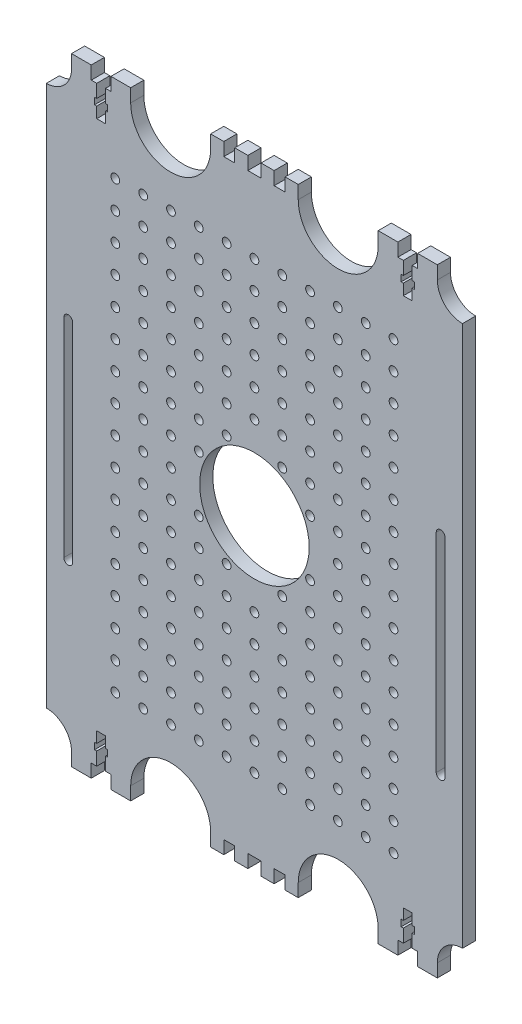
from build123d import *

# Parameters (mm, degrees)
ESQUISSE1_W               = 190
ESQUISSE1_H               = 270
BOSS_EXTRU_1_DEPTH        = 6
ESQUISSE2_W               = 9
ESQUISSE2_H               = 6
BOSS_EXTRU_2_DEPTH        = 6
ENL_V_MAT_EXTRU_1_DEPTH   = 6
SYM_TRIE2_COPY_1_SKETCH_W = 9
SYM_TRIE2_COPY_1_SKETCH_H = 6
SYM_TRIE2_COPY_1_DEPTH    = 6
SYM_TRIE2_COPY_2_DEPTH    = 6
ESQUISSE4_W               = 6
ESQUISSE4_H               = 6
BOSS_EXTRU_3_DEPTH        = 6
ESQUISSE6_R               = 18.25
ESQUISSE6_R_2             = 11.5
ESQUISSE6_R_3             = 25
ENL_V_MAT_EXTRU_2_DEPTH   = 6
ENL_V_MAT_EXTRU_3_DEPTH   = 6
ESQUISSE8_R               = 2
ENL_V_MAT_EXTRU_4_DEPTH   = 6


with BuildPart() as part:
    # Esquisse1 → Boss.-Extru.1 (new body)
    with BuildSketch(Plane.XY):
        Rectangle(ESQUISSE1_W, ESQUISSE1_H)
    extrude(amount=BOSS_EXTRU_1_DEPTH)

    # Esquisse2 → Boss.-Extru.2 (add)
    with BuildSketch(Plane.XZ.offset(135)):
        with Locations((-79, 3)):
            Rectangle(ESQUISSE2_W, ESQUISSE2_H)
        with Locations((-61, 3)):
            Rectangle(ESQUISSE2_W, ESQUISSE2_H)
    boss_extru_2 = extrude(amount=BOSS_EXTRU_2_DEPTH)

    # Esquisse3 → Enlèv. mat.-Extru.1 (cut)
    with BuildSketch(Plane(origin=(0, 0, 0), x_dir=(-1, 0, 0), z_dir=(0, 0, -1))):
        Polygon((68, -135), (72, -135), (72, -129), (73, -129), (73, -126), (72, -126), (72, -121), (68, -121), (68, -126), (67, -126), (67, -129), (68, -129), align=None)
    enl_v_mat_extru_1 = extrude(amount=-ENL_V_MAT_EXTRU_1_DEPTH, mode=Mode.SUBTRACT)

    # Symétrie1: Boss.-Extru.2, Enlèv. mat.-Extru.1 across plane
    add(boss_extru_2.mirror(Plane.ZX))
    add(enl_v_mat_extru_1.mirror(Plane.ZX), mode=Mode.SUBTRACT)

    # Symétrie2: Boss.-Extru.2, Enlèv. mat.-Extru.1 across plane
    add(boss_extru_2.mirror(Plane.ZY))
    add(enl_v_mat_extru_1.mirror(Plane.ZY), mode=Mode.SUBTRACT)

    # Symétrie2 copy 1 sketch → Symétrie2 copy 1 (add)
    with BuildSketch(Plane(origin=(0, 135, 0), x_dir=(-1, 0, 0), z_dir=(0, 1, 0))):
        with Locations((-79, 3)):
            Rectangle(SYM_TRIE2_COPY_1_SKETCH_W, SYM_TRIE2_COPY_1_SKETCH_H)
        with Locations((-61, 3)):
            Rectangle(SYM_TRIE2_COPY_1_SKETCH_W, SYM_TRIE2_COPY_1_SKETCH_H)
    extrude(amount=SYM_TRIE2_COPY_1_DEPTH)

    # Symétrie2 copy 2 sketch → Symétrie2 copy 2 (cut)
    with BuildSketch(Plane(origin=(0, 0, 0), x_dir=(1, 0, 0), z_dir=(0, 0, -1))):
        Polygon((68, -135), (72, -135), (72, -129), (73, -129), (73, -126), (72, -126), (72, -121), (68, -121), (68, -126), (67, -126), (67, -129), (68, -129), align=None)
    extrude(amount=-SYM_TRIE2_COPY_2_DEPTH, mode=Mode.SUBTRACT)

    # Esquisse4 → Boss.-Extru.3 (add)
    with BuildSketch(Plane.XZ.offset(135)):
        with Locations((17, 3)):
            Rectangle(ESQUISSE4_W, ESQUISSE4_H)
        with Locations((6, 3)):
            Rectangle(ESQUISSE4_W, ESQUISSE4_H)
        with Locations((-17, 3)):
            Rectangle(ESQUISSE4_W, ESQUISSE4_H)
        with Locations((-6, 3)):
            Rectangle(ESQUISSE4_W, ESQUISSE4_H)
    boss_extru_3 = extrude(amount=BOSS_EXTRU_3_DEPTH)

    # Symétrie3: Boss.-Extru.3 across plane
    add(boss_extru_3.mirror(Plane.ZX))

    # Esquisse6 → Enlèv. mat.-Extru.2 (cut)
    with BuildSketch(Plane.XY.offset(6)):
        with Locations((-38.25, 135)):
            Circle(ESQUISSE6_R)
        with Locations((38.25, 135)):
            Circle(ESQUISSE6_R)
        with Locations((-38.25, -135)):
            Circle(ESQUISSE6_R)
        with Locations((38.25, -135)):
            Circle(ESQUISSE6_R)
        with Locations((-95, 135)):
            Circle(ESQUISSE6_R_2)
        with Locations((95, 135)):
            Circle(ESQUISSE6_R_2)
        with Locations((95, -135)):
            Circle(ESQUISSE6_R_2)
        with Locations((-95, -135)):
            Circle(ESQUISSE6_R_2)
        Circle(ESQUISSE6_R_3)
    extrude(amount=-ENL_V_MAT_EXTRU_2_DEPTH, mode=Mode.SUBTRACT)

    # Esquisse7 → Enlèv. mat.-Extru.3 (cut)
    with BuildSketch(Plane.XY.offset(6)):
        with BuildLine():
            Line((87, 35), (87, -60))
            ThreePointArc((87, -60), (85, -62), (83, -60))
            Line((83, -60), (83, 35))
            ThreePointArc((83, 35), (85, 37), (87, 35))
        make_face()
    enl_v_mat_extru_3 = extrude(amount=-ENL_V_MAT_EXTRU_3_DEPTH, mode=Mode.SUBTRACT)

    # Symétrie4: Enlèv. mat.-Extru.3 across plane
    add(enl_v_mat_extru_3.mirror(Plane(origin=(0, 0, 0), x_dir=(0, 0, 1), z_dir=(1, 0, 0))), mode=Mode.SUBTRACT)

    # Esquisse8 → Enlèv. mat.-Extru.4 (cut)
    with BuildSketch(Plane.XY.offset(6)):
        Circle(ESQUISSE8_R)
        with Locations((0, -12.7)):
            Circle(ESQUISSE8_R)
        with Locations((0, -38.1)):
            Circle(ESQUISSE8_R)
        with Locations((0, -50.8)):
            Circle(ESQUISSE8_R)
        with Locations((0, -63.5)):
            Circle(ESQUISSE8_R)
        with Locations((0, -76.2)):
            Circle(ESQUISSE8_R)
        with Locations((0, -88.9)):
            Circle(ESQUISSE8_R)
        with Locations((0, -101.6)):
            Circle(ESQUISSE8_R)
        with Locations((-12.7, -12.7)):
            Circle(ESQUISSE8_R)
        with Locations((-12.7, -25.4)):
            Circle(ESQUISSE8_R)
        with Locations((-12.7, -38.1)):
            Circle(ESQUISSE8_R)
        with Locations((-12.7, -50.8)):
            Circle(ESQUISSE8_R)
        with Locations((-12.7, -63.5)):
            Circle(ESQUISSE8_R)
        with Locations((-12.7, -76.2)):
            Circle(ESQUISSE8_R)
        with Locations((-12.7, -88.9)):
            Circle(ESQUISSE8_R)
        with Locations((-12.7, -101.6)):
            Circle(ESQUISSE8_R)
        with Locations((-25.4, -12.7)):
            Circle(ESQUISSE8_R)
        with Locations((-25.4, -25.4)):
            Circle(ESQUISSE8_R)
        with Locations((-25.4, -38.1)):
            Circle(ESQUISSE8_R)
        with Locations((-25.4, -50.8)):
            Circle(ESQUISSE8_R)
        with Locations((-25.4, -63.5)):
            Circle(ESQUISSE8_R)
        with Locations((-25.4, -76.2)):
            Circle(ESQUISSE8_R)
        with Locations((-25.4, -88.9)):
            Circle(ESQUISSE8_R)
        with Locations((-25.4, -101.6)):
            Circle(ESQUISSE8_R)
        with Locations((-38.1, -12.7)):
            Circle(ESQUISSE8_R)
        with Locations((-38.1, -25.4)):
            Circle(ESQUISSE8_R)
        with Locations((-38.1, -38.1)):
            Circle(ESQUISSE8_R)
        with Locations((-38.1, -50.8)):
            Circle(ESQUISSE8_R)
        with Locations((-38.1, -63.5)):
            Circle(ESQUISSE8_R)
        with Locations((-38.1, -76.2)):
            Circle(ESQUISSE8_R)
        with Locations((-38.1, -88.9)):
            Circle(ESQUISSE8_R)
        with Locations((-38.1, -101.6)):
            Circle(ESQUISSE8_R)
        with Locations((-50.8, -12.7)):
            Circle(ESQUISSE8_R)
        with Locations((-50.8, -25.4)):
            Circle(ESQUISSE8_R)
        with Locations((-50.8, -38.1)):
            Circle(ESQUISSE8_R)
        with Locations((-50.8, -50.8)):
            Circle(ESQUISSE8_R)
        with Locations((-50.8, -63.5)):
            Circle(ESQUISSE8_R)
        with Locations((-50.8, -76.2)):
            Circle(ESQUISSE8_R)
        with Locations((-50.8, -88.9)):
            Circle(ESQUISSE8_R)
        with Locations((-50.8, -101.6)):
            Circle(ESQUISSE8_R)
        with Locations((-63.5, -12.7)):
            Circle(ESQUISSE8_R)
        with Locations((-63.5, -25.4)):
            Circle(ESQUISSE8_R)
        with Locations((-63.5, -38.1)):
            Circle(ESQUISSE8_R)
        with Locations((-63.5, -50.8)):
            Circle(ESQUISSE8_R)
        with Locations((-63.5, -63.5)):
            Circle(ESQUISSE8_R)
        with Locations((-63.5, -76.2)):
            Circle(ESQUISSE8_R)
        with Locations((-63.5, -88.9)):
            Circle(ESQUISSE8_R)
        with Locations((-63.5, -101.6)):
            Circle(ESQUISSE8_R)
        with Locations((-12.7, 0)):
            Circle(ESQUISSE8_R)
        with Locations((-38.1, 0)):
            Circle(ESQUISSE8_R)
        with Locations((-50.8, 0)):
            Circle(ESQUISSE8_R)
        with Locations((-63.5, 0)):
            Circle(ESQUISSE8_R)
        with Locations((0, 12.7)):
            Circle(ESQUISSE8_R)
        with Locations((-12.7, 12.7)):
            Circle(ESQUISSE8_R)
        with Locations((-25.4, 12.7)):
            Circle(ESQUISSE8_R)
        with Locations((-38.1, 12.7)):
            Circle(ESQUISSE8_R)
        with Locations((-50.8, 12.7)):
            Circle(ESQUISSE8_R)
        with Locations((-63.5, 12.7)):
            Circle(ESQUISSE8_R)
        with Locations((-12.7, 25.4)):
            Circle(ESQUISSE8_R)
        with Locations((-25.4, 25.4)):
            Circle(ESQUISSE8_R)
        with Locations((-38.1, 25.4)):
            Circle(ESQUISSE8_R)
        with Locations((-50.8, 25.4)):
            Circle(ESQUISSE8_R)
        with Locations((-63.5, 25.4)):
            Circle(ESQUISSE8_R)
        with Locations((0, 38.1)):
            Circle(ESQUISSE8_R)
        with Locations((-12.7, 38.1)):
            Circle(ESQUISSE8_R)
        with Locations((-25.4, 38.1)):
            Circle(ESQUISSE8_R)
        with Locations((-38.1, 38.1)):
            Circle(ESQUISSE8_R)
        with Locations((-50.8, 38.1)):
            Circle(ESQUISSE8_R)
        with Locations((-63.5, 38.1)):
            Circle(ESQUISSE8_R)
        with Locations((0, 50.8)):
            Circle(ESQUISSE8_R)
        with Locations((-12.7, 50.8)):
            Circle(ESQUISSE8_R)
        with Locations((-25.4, 50.8)):
            Circle(ESQUISSE8_R)
        with Locations((-38.1, 50.8)):
            Circle(ESQUISSE8_R)
        with Locations((-50.8, 50.8)):
            Circle(ESQUISSE8_R)
        with Locations((-63.5, 50.8)):
            Circle(ESQUISSE8_R)
        with Locations((0, 63.5)):
            Circle(ESQUISSE8_R)
        with Locations((-12.7, 63.5)):
            Circle(ESQUISSE8_R)
        with Locations((-25.4, 63.5)):
            Circle(ESQUISSE8_R)
        with Locations((-38.1, 63.5)):
            Circle(ESQUISSE8_R)
        with Locations((-50.8, 63.5)):
            Circle(ESQUISSE8_R)
        with Locations((-63.5, 63.5)):
            Circle(ESQUISSE8_R)
        with Locations((0, 76.2)):
            Circle(ESQUISSE8_R)
        with Locations((-12.7, 76.2)):
            Circle(ESQUISSE8_R)
        with Locations((-25.4, 76.2)):
            Circle(ESQUISSE8_R)
        with Locations((-38.1, 76.2)):
            Circle(ESQUISSE8_R)
        with Locations((-50.8, 76.2)):
            Circle(ESQUISSE8_R)
        with Locations((-63.5, 76.2)):
            Circle(ESQUISSE8_R)
        with Locations((0, 88.9)):
            Circle(ESQUISSE8_R)
        with Locations((-12.7, 88.9)):
            Circle(ESQUISSE8_R)
        with Locations((-25.4, 88.9)):
            Circle(ESQUISSE8_R)
        with Locations((-38.1, 88.9)):
            Circle(ESQUISSE8_R)
        with Locations((-50.8, 88.9)):
            Circle(ESQUISSE8_R)
        with Locations((-63.5, 88.9)):
            Circle(ESQUISSE8_R)
        with Locations((0, 101.6)):
            Circle(ESQUISSE8_R)
        with Locations((-12.7, 101.6)):
            Circle(ESQUISSE8_R)
        with Locations((-25.4, 101.6)):
            Circle(ESQUISSE8_R)
        with Locations((-38.1, 101.6)):
            Circle(ESQUISSE8_R)
        with Locations((-50.8, 101.6)):
            Circle(ESQUISSE8_R)
        with Locations((-63.5, 101.6)):
            Circle(ESQUISSE8_R)
        with Locations((12.7, 101.6)):
            Circle(ESQUISSE8_R)
        with Locations((12.7, 88.9)):
            Circle(ESQUISSE8_R)
        with Locations((12.7, 76.2)):
            Circle(ESQUISSE8_R)
        with Locations((12.7, 63.5)):
            Circle(ESQUISSE8_R)
        with Locations((12.7, 50.8)):
            Circle(ESQUISSE8_R)
        with Locations((12.7, 38.1)):
            Circle(ESQUISSE8_R)
        with Locations((12.7, 25.4)):
            Circle(ESQUISSE8_R)
        with Locations((12.7, 12.7)):
            Circle(ESQUISSE8_R)
        with Locations((12.7, 0)):
            Circle(ESQUISSE8_R)
        with Locations((12.7, -12.7)):
            Circle(ESQUISSE8_R)
        with Locations((12.7, -25.4)):
            Circle(ESQUISSE8_R)
        with Locations((12.7, -38.1)):
            Circle(ESQUISSE8_R)
        with Locations((12.7, -50.8)):
            Circle(ESQUISSE8_R)
        with Locations((12.7, -63.5)):
            Circle(ESQUISSE8_R)
        with Locations((12.7, -76.2)):
            Circle(ESQUISSE8_R)
        with Locations((12.7, -88.9)):
            Circle(ESQUISSE8_R)
        with Locations((12.7, -101.6)):
            Circle(ESQUISSE8_R)
        with Locations((25.4, 101.6)):
            Circle(ESQUISSE8_R)
        with Locations((25.4, 88.9)):
            Circle(ESQUISSE8_R)
        with Locations((25.4, 76.2)):
            Circle(ESQUISSE8_R)
        with Locations((25.4, 63.5)):
            Circle(ESQUISSE8_R)
        with Locations((25.4, 50.8)):
            Circle(ESQUISSE8_R)
        with Locations((25.4, 38.1)):
            Circle(ESQUISSE8_R)
        with Locations((25.4, 25.4)):
            Circle(ESQUISSE8_R)
        with Locations((25.4, 12.7)):
            Circle(ESQUISSE8_R)
        with Locations((25.4, -12.7)):
            Circle(ESQUISSE8_R)
        with Locations((25.4, -25.4)):
            Circle(ESQUISSE8_R)
        with Locations((25.4, -38.1)):
            Circle(ESQUISSE8_R)
        with Locations((25.4, -50.8)):
            Circle(ESQUISSE8_R)
        with Locations((25.4, -63.5)):
            Circle(ESQUISSE8_R)
        with Locations((25.4, -76.2)):
            Circle(ESQUISSE8_R)
        with Locations((25.4, -88.9)):
            Circle(ESQUISSE8_R)
        with Locations((25.4, -101.6)):
            Circle(ESQUISSE8_R)
        with Locations((38.1, 101.6)):
            Circle(ESQUISSE8_R)
        with Locations((38.1, 88.9)):
            Circle(ESQUISSE8_R)
        with Locations((38.1, 76.2)):
            Circle(ESQUISSE8_R)
        with Locations((38.1, 63.5)):
            Circle(ESQUISSE8_R)
        with Locations((38.1, 50.8)):
            Circle(ESQUISSE8_R)
        with Locations((38.1, 38.1)):
            Circle(ESQUISSE8_R)
        with Locations((38.1, 25.4)):
            Circle(ESQUISSE8_R)
        with Locations((38.1, 12.7)):
            Circle(ESQUISSE8_R)
        with Locations((38.1, 0)):
            Circle(ESQUISSE8_R)
        with Locations((38.1, -12.7)):
            Circle(ESQUISSE8_R)
        with Locations((38.1, -25.4)):
            Circle(ESQUISSE8_R)
        with Locations((38.1, -38.1)):
            Circle(ESQUISSE8_R)
        with Locations((38.1, -50.8)):
            Circle(ESQUISSE8_R)
        with Locations((38.1, -63.5)):
            Circle(ESQUISSE8_R)
        with Locations((38.1, -76.2)):
            Circle(ESQUISSE8_R)
        with Locations((38.1, -88.9)):
            Circle(ESQUISSE8_R)
        with Locations((38.1, -101.6)):
            Circle(ESQUISSE8_R)
        with Locations((50.8, 101.6)):
            Circle(ESQUISSE8_R)
        with Locations((50.8, 88.9)):
            Circle(ESQUISSE8_R)
        with Locations((50.8, 76.2)):
            Circle(ESQUISSE8_R)
        with Locations((50.8, 63.5)):
            Circle(ESQUISSE8_R)
        with Locations((50.8, 50.8)):
            Circle(ESQUISSE8_R)
        with Locations((50.8, 38.1)):
            Circle(ESQUISSE8_R)
        with Locations((50.8, 25.4)):
            Circle(ESQUISSE8_R)
        with Locations((50.8, 12.7)):
            Circle(ESQUISSE8_R)
        with Locations((50.8, 0)):
            Circle(ESQUISSE8_R)
        with Locations((50.8, -12.7)):
            Circle(ESQUISSE8_R)
        with Locations((50.8, -25.4)):
            Circle(ESQUISSE8_R)
        with Locations((50.8, -38.1)):
            Circle(ESQUISSE8_R)
        with Locations((50.8, -50.8)):
            Circle(ESQUISSE8_R)
        with Locations((50.8, -63.5)):
            Circle(ESQUISSE8_R)
        with Locations((50.8, -76.2)):
            Circle(ESQUISSE8_R)
        with Locations((50.8, -88.9)):
            Circle(ESQUISSE8_R)
        with Locations((50.8, -101.6)):
            Circle(ESQUISSE8_R)
        with Locations((63.5, 101.6)):
            Circle(ESQUISSE8_R)
        with Locations((63.5, 88.9)):
            Circle(ESQUISSE8_R)
        with Locations((63.5, 76.2)):
            Circle(ESQUISSE8_R)
        with Locations((63.5, 63.5)):
            Circle(ESQUISSE8_R)
        with Locations((63.5, 50.8)):
            Circle(ESQUISSE8_R)
        with Locations((63.5, 38.1)):
            Circle(ESQUISSE8_R)
        with Locations((63.5, 25.4)):
            Circle(ESQUISSE8_R)
        with Locations((63.5, 12.7)):
            Circle(ESQUISSE8_R)
        with Locations((63.5, 0)):
            Circle(ESQUISSE8_R)
        with Locations((63.5, -12.7)):
            Circle(ESQUISSE8_R)
        with Locations((63.5, -25.4)):
            Circle(ESQUISSE8_R)
        with Locations((63.5, -38.1)):
            Circle(ESQUISSE8_R)
        with Locations((63.5, -50.8)):
            Circle(ESQUISSE8_R)
        with Locations((63.5, -63.5)):
            Circle(ESQUISSE8_R)
        with Locations((63.5, -76.2)):
            Circle(ESQUISSE8_R)
        with Locations((63.5, -88.9)):
            Circle(ESQUISSE8_R)
        with Locations((63.5, -101.6)):
            Circle(ESQUISSE8_R)
    extrude(amount=-ENL_V_MAT_EXTRU_4_DEPTH, mode=Mode.SUBTRACT)


solid = part.part
